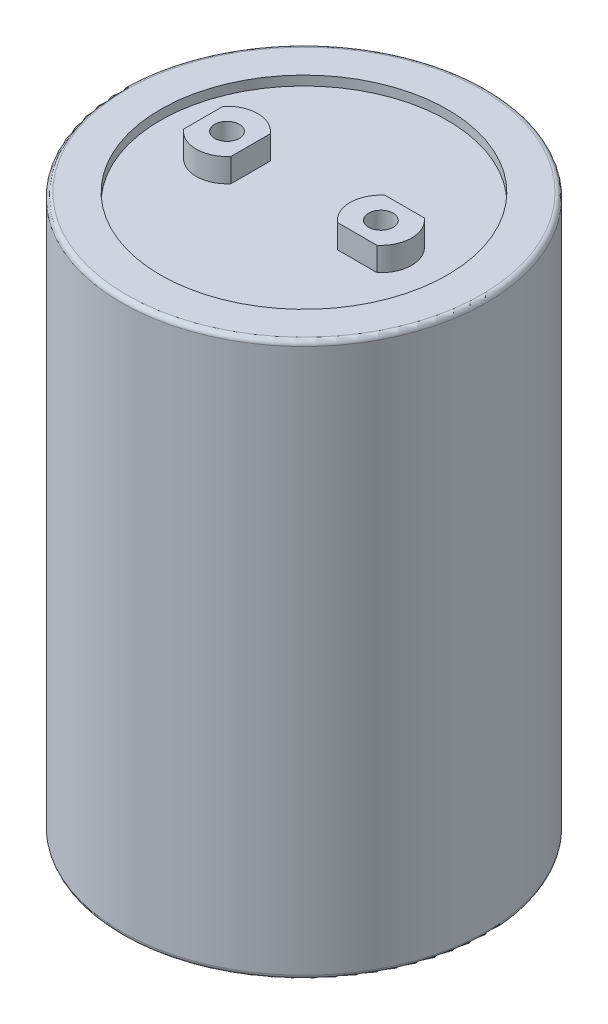
from build123d import *

# Parameters (mm, degrees)
SKETCH1_R           = 38.5
BOSS_EXTRUDE1_DEPTH = 115
SKETCH2_R           = 2.6
BOSS_EXTRUDE2_DEPTH = 5
SKETCH3_R           = 38.5
SKETCH3_R_2         = 30.3
BOSS_EXTRUDE3_DEPTH = 2
FILLET1_R           = 1


with BuildPart() as part:
    # Sketch1 → Boss-Extrude1 (new body)
    with BuildSketch(Plane(origin=(0, 0, 0), x_dir=(1, 0, 0), z_dir=(0, 1, 0))):
        with Locations(Location((0, 0, 0), (0, 0, 270))):
            Circle(SKETCH1_R)
    extrude(amount=BOSS_EXTRUDE1_DEPTH)

    # Sketch2 → Boss-Extrude2 (add)
    # profile 1 of 2: a face of its own
    with BuildSketch(Plane(origin=(0, 115, 0), x_dir=(1, 0, 0), z_dir=(0, 1, 0))):
        with BuildLine():
            Line((-21.25, 4.153311931), (-21.25, -4.153311931))
            ThreePointArc((-21.25, -4.153311931), (-16.25, -6.5), (-11.25, -4.153311931))
            Line((-11.25, -4.153311931), (-11.25, 4.153311931))
            ThreePointArc((-11.25, 4.153311931), (-16.25, 6.5), (-21.25, 4.153311931))
        make_face()
        with Locations(Location((-16.25, 0, 0), (0, 0, 270))):
            Circle(SKETCH2_R, mode=Mode.SUBTRACT)
    # profile 2 of 2: a face of its own
    with BuildSketch(Plane(origin=(0, 115, 0), x_dir=(1, 0, 0), z_dir=(0, 1, 0))):
        with BuildLine():
            Line((12.096688069, 5), (20.403311931, 5))
            ThreePointArc((20.403311931, 5), (22.75, 0), (20.403311931, -5))
            Line((20.403311931, -5), (12.096688069, -5))
            ThreePointArc((12.096688069, -5), (9.75, 0), (12.096688069, 5))
        make_face()
        with Locations(Location((16.25, 0, 0), (0, 0, 270))):
            Circle(SKETCH2_R, mode=Mode.SUBTRACT)
    extrude(amount=BOSS_EXTRUDE2_DEPTH)

    # Sketch3 → Boss-Extrude3 (add)
    with BuildSketch(Plane(origin=(0, 115, 0), x_dir=(1, 0, 0), z_dir=(0, 1, 0))):
        with Locations(Location((0, 0, 0), (0, 0, 270))):
            Circle(SKETCH3_R)
        with Locations(Location((0, 0, 0), (0, 0, 270))):
            Circle(SKETCH3_R_2, mode=Mode.SUBTRACT)
    extrude(amount=BOSS_EXTRUDE3_DEPTH)

    # Fillet1
    fillet1_edges = [part.edges().sort_by_distance(p)[0] for p in [
        (0, 0, -38.5),
        (0, 117, -38.5),
    ]]
    fillet(fillet1_edges, radius=FILLET1_R)


solid = part.part
